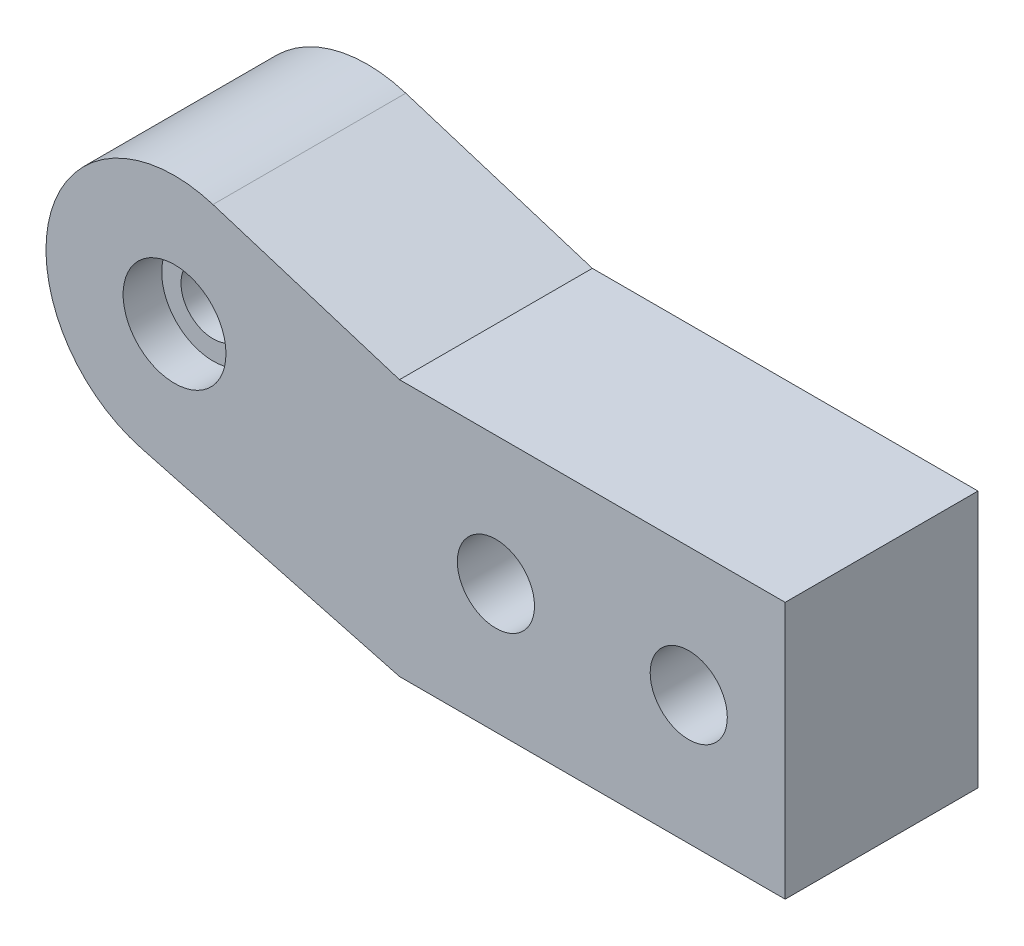
from build123d import *

# Parameters (mm, degrees)
SKETCH_1_R          = 3
EXTRUDE_1_DEPTH     = 15
SKETCH_4_R          = 5
CUT_EXTRUDE_3_DEPTH = 6
SKETCH_8_R          = 4
CUT_EXTRUDE_4_DEPTH = 3
SKETCH_10_R         = 2.5
CUT_EXTRUDE_5_DEPTH = 13


with BuildPart() as part:
    # 草图1 → 凸台-拉伸1 (new body)
    with BuildSketch(Plane.XY):
        with BuildLine():
            Line((-30, 0), (0, 0))
            Line((0, 0), (0, -20))
            Line((0, -20), (-30, -20))
            Line((-30, -20), (-50.06938155, -14.664278475))
            ThreePointArc((-50.06938155, -14.664278475), (-57.106051537, -2.220832162), (-44.512363219, 4.543271266))
            Line((-44.512363219, 4.543271266), (-30, 0))
        make_face()
        with Locations((-22.5, -10)):
            Circle(SKETCH_1_R, mode=Mode.SUBTRACT)
        with Locations((-7.5, -10)):
            Circle(SKETCH_1_R, mode=Mode.SUBTRACT)
    extrude(amount=EXTRUDE_1_DEPTH)

    # 草图4 → 切除-拉伸3 (cut)
    with BuildSketch(Plane(origin=(0, 0, 0), x_dir=(-1, 0, 0), z_dir=(0, 0, -1))):
        with Locations((7.5, -10)):
            Circle(SKETCH_4_R)
        with Locations((22.5, -10)):
            Circle(SKETCH_4_R)
    extrude(amount=-CUT_EXTRUDE_3_DEPTH, mode=Mode.SUBTRACT)

    # 草图8 → 切除-拉伸4 (cut)
    with BuildSketch(Plane.XY.offset(15)):
        with Locations((-47.5, -5)):
            Circle(SKETCH_8_R)
    extrude(amount=-CUT_EXTRUDE_4_DEPTH, mode=Mode.SUBTRACT)

    # 草图10 → 切除-拉伸5 (cut)
    with BuildSketch(Plane.XY.offset(12)):
        with Locations((-47.5, -5)):
            Circle(SKETCH_10_R)
    extrude(amount=-CUT_EXTRUDE_5_DEPTH, mode=Mode.SUBTRACT)


solid = part.part
